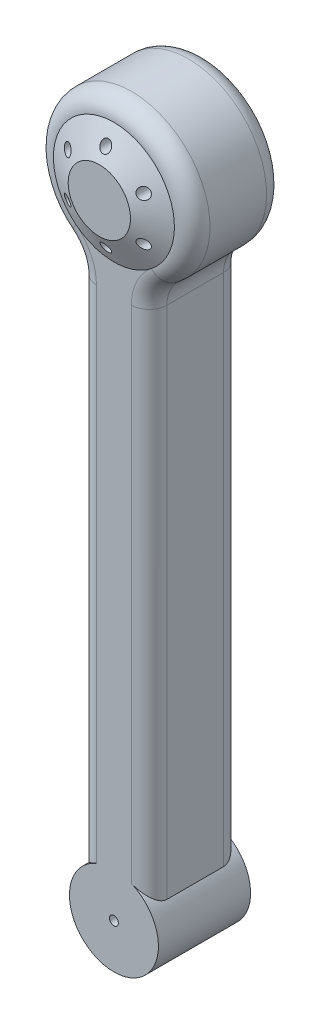
from build123d import *

# Parameters (mm, degrees)
Y_KSEKLIK_EKSTR_ZYON2_DEPTH = 51.8
IZIM3_R                     = 2.5
KES_EKSTR_ZYON1_DEPTH       = 20
KES_EKSTR_ZYON2_START       = -20
IZIM4_R                     = 2.5
KES_EKSTR_ZYON2_DEPTH       = 20
RADYUS1_R                   = 20
IZIM5_W                     = 42
IZIM5_H                     = 42
KES_EKSTR_ZYON3_DEPTH       = 23
RADYUS2_R                   = 10
IZIM6_R                     = 34
IZIM7_R                     = 17.5
KES_EKSTR_ZYON5_DEPTH       = 12.5
KES_EKSTR_ZYON5_DEPTH_BACK  = 20
IZIM10_R                    = 3


with BuildPart() as part:
    # Çizim2 → Yükseklik-Ekstrüzyon2 (new body)
    with BuildSketch(Plane.XY):
        with BuildLine():
            Line((19.817016852, 315.240926583), (19.817016852, 15.240926583))
            ThreePointArc((19.817016852, 15.240926583), (0, -25), (-19.817016852, 15.240926583))
            Line((-19.817016852, 15.240926583), (-19.817016852, 315.240926583))
            ThreePointArc((-19.817016852, 315.240926583), (0, 398.525603533), (19.817016852, 315.240926583))
        make_face()
    extrude(amount=Y_KSEKLIK_EKSTR_ZYON2_DEPTH)

    # Çizim3 → Kes-Ekstrüzyon1 (cut)
    with BuildSketch(Plane.XY.offset(51.8)):
        Circle(IZIM3_R)
    extrude(amount=-KES_EKSTR_ZYON1_DEPTH, mode=Mode.SUBTRACT)

    # Çizim4 → Kes-Ekstrüzyon2 (cut)
    with BuildSketch(Plane(origin=(0, 0, 0), x_dir=(-1, 0, 0), z_dir=(0, 0, -1)).offset(KES_EKSTR_ZYON2_START)):
        with Locations(Location((0, 0, 0), (0, 0, 180))):
            Circle(IZIM4_R)
    extrude(amount=KES_EKSTR_ZYON2_DEPTH, mode=Mode.SUBTRACT)

    # Radyus1
    radyus1_edges = [part.edges().sort_by_distance(p)[0] for p in [
        (19.817016852, 315.240926583, 25.9),
        (-19.817016852, 315.240926583, 25.9),
    ]]
    fillet(radyus1_edges, radius=RADYUS1_R)

    # Çizim5 → Kes-Ekstrüzyon3 (cut)
    with BuildSketch(Plane(origin=(0, 0, 0), x_dir=(-1, 0, 0), z_dir=(0, 0, -1))):
        with Locations((0, 354.525603533)):
            Rectangle(IZIM5_W, IZIM5_H)
    extrude(amount=-KES_EKSTR_ZYON3_DEPTH, mode=Mode.SUBTRACT)

    # Radyus2
    radyus2_edges = [part.edges().sort_by_distance(p)[0] for p in [
        (19.817016852, 159.830295328, 51.8),
        (0, 398.525603533, 0),
        (0, 398.525603533, 51.8),
        (-19.817016852, 159.830295328, 0),
        (-19.817016852, 159.830295328, 51.8),
        (21.805126955, 313.112869602, 0),
        (21.805126955, 313.112869602, 51.8),
        (-21.805126955, 313.112869602, 0),
        (-21.805126955, 313.112869602, 51.8),
        (19.817016852, 159.830295328, 0),
    ]]
    fillet(radyus2_edges, radius=RADYUS2_R)

    # Çizim6 → Loft1 section 0
    with BuildSketch(Plane.XY.offset(51.8)):
        with Locations((0, 354.525603533)):
            Circle(IZIM6_R)
    # Çizim7 → Loft1 section 1
    with BuildSketch(Plane.XY.offset(60)):
        with Locations((0, 354.525603533)):
            Circle(IZIM7_R)
    loft()

    # Çizim10 → Kes-Ekstrüzyon5 (cut, two sides: drawn at the far end of the back side and taken through both)
    with BuildSketch(Plane.XY.offset(60).offset(-KES_EKSTR_ZYON5_DEPTH_BACK)):
        with Locations(Location((0, 379.197838757, 0), (0, 0, 148.251352677))):
            Circle(IZIM10_R)
        with Locations(Location((21.366782472, 366.861721145, 0), (0, 0, 107.255067977))):
            Circle(IZIM10_R)
        with Locations(Location((21.366782472, 342.189485921, 0), (0, 0, 248.384791205))):
            Circle(IZIM10_R)
        with Locations(Location((0, 329.853368309, 0), (0, 0, 227.572766065))):
            Circle(IZIM10_R)
        with Locations(Location((-21.366782472, 342.189485921, 0), (0, 0, 213.645066656))):
            Circle(IZIM10_R)
        with Locations(Location((-21.366782472, 366.861721145, 0), (0, 0, 207.915293441))):
            Circle(IZIM10_R)
    extrude(amount=KES_EKSTR_ZYON5_DEPTH + KES_EKSTR_ZYON5_DEPTH_BACK, mode=Mode.SUBTRACT)


solid = part.part
